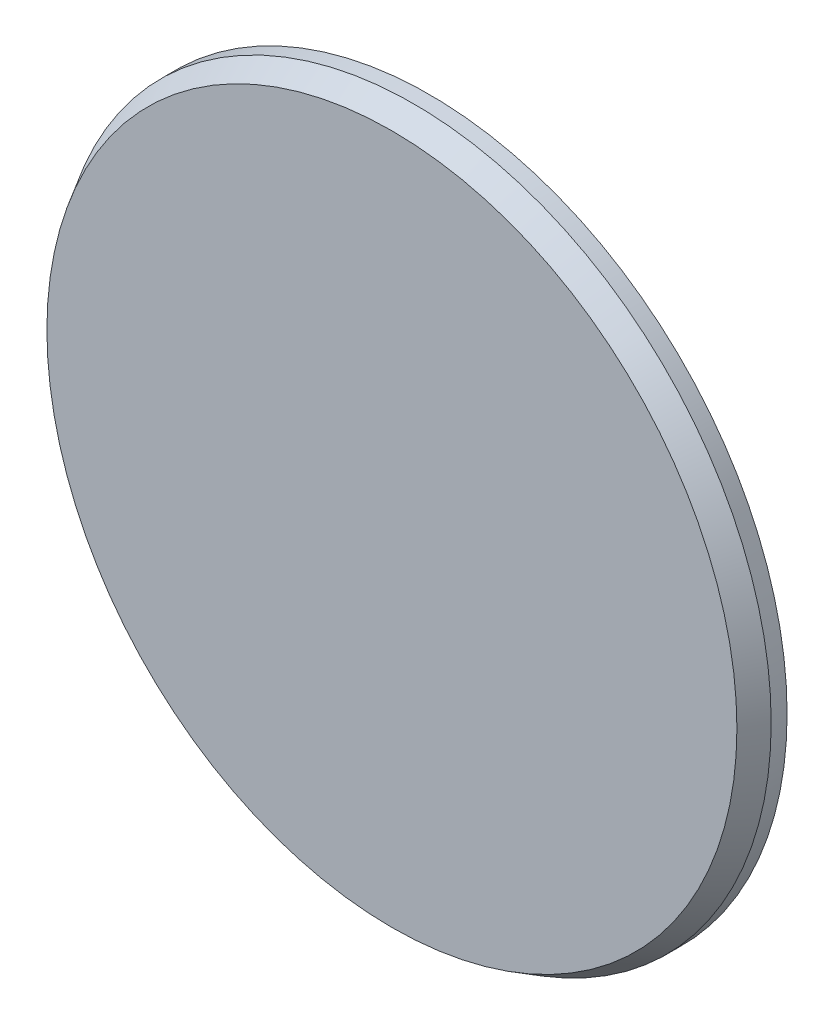
from build123d import *

# Parameters (mm, degrees)
ESQUISSE1_R        = 28.5
BOSS_EXTRU_1_DEPTH = 3
CHANFREIN1_SIZE    = 1
CHANFREIN1_SIZE2   = 1.732050808


with BuildPart() as part:
    # Esquisse1 → Boss.-Extru.1 (new body)
    with BuildSketch(Plane.XY):
        Circle(ESQUISSE1_R)
    extrude(amount=BOSS_EXTRU_1_DEPTH)

    # Chanfrein1
    chanfrein1_edges = [part.edges().sort_by_distance(p)[0] for p in [
        (-28.5, 0, 3),
    ]]
    chanfrein1_side = [part.faces().sort_by_distance(p)[0] for p in [
        (0, 0, 3),
    ]]
    chamfer(chanfrein1_edges, length=CHANFREIN1_SIZE, length2=CHANFREIN1_SIZE2, reference=chanfrein1_side[0])


solid = part.part
